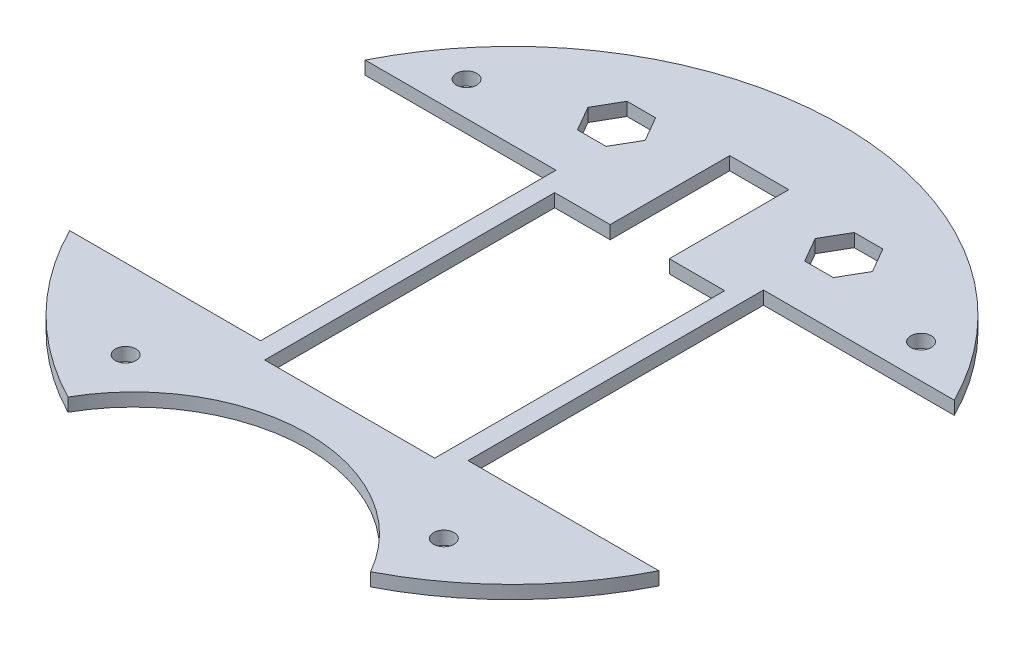
from build123d import *

# Parameters (mm, degrees)
BOSS_EXTRUDE1_DEPTH  = 2.9
SOLENOID_PLACEMENT_W = 37.4
SOLENOID_PLACEMENT_H = 63.8
CUT_EXTRUDE1_DEPTH   = 103.571487266
CUT_EXTRUDE3_DEPTH   = 103.571487266
SKETCH4_W            = 13
SKETCH4_H            = 26.3
CUT_EXTRUDE4_DEPTH   = 98.286484159
CUT_EXTRUDE5_DEPTH   = 98.286484159
SKETCH6_R            = 2.25
CUT_EXTRUDE6_DEPTH   = 98.286484159


with BuildPart() as part:
    # Sketch1 → Boss-Extrude1 (new body)
    with BuildSketch(Plane(origin=(0, 0, 0), x_dir=(1, 0, 0), z_dir=(0, 1, 0))):
        with BuildLine():
            ThreePointArc((33.29110537, -64.404598464), (0, 72.5), (-33.29110537, -64.404598464))
            ThreePointArc((-33.29110537, -64.404598464), (0, -44.989799638), (33.29110537, -64.404598464))
        make_face()
    extrude(amount=BOSS_EXTRUDE1_DEPTH)

    # solenoid placement → Cut-Extrude1 (cut, through all)
    with BuildSketch(Plane(origin=(0, 2.9, 0), x_dir=(1, 0, 0), z_dir=(0, 1, 0))):
        with Locations((0, -3.8)):
            Rectangle(SOLENOID_PLACEMENT_W, SOLENOID_PLACEMENT_H)
    extrude(amount=-CUT_EXTRUDE1_DEPTH, mode=Mode.SUBTRACT)

    # Sketch3 → Cut-Extrude3 (cut, through all)
    with BuildSketch(Plane(origin=(0, 2.9, 0), x_dir=(1, 0, 0), z_dir=(0, 1, 0))):
        with BuildLine():
            Line((-34.63, -32.5), (-22.83, -32.5))
            Line((-22.83, -32.5), (-22.83, 32.5))
            Line((-22.83, 32.5), (-64.807406984, 32.5))
            ThreePointArc((-64.807406984, 32.5), (-72.5, 0), (-64.807406984, -32.5))
            Line((-64.807406984, -32.5), (-34.63, -32.5))
        make_face()
        with BuildLine():
            Line((34.63, -32.5), (64.807406984, -32.5))
            ThreePointArc((64.807406984, -32.5), (72.5, 0), (64.807406984, 32.5))
            Line((64.807406984, 32.5), (22.83, 32.5))
            Line((22.83, 32.5), (22.83, -32.5))
            Line((22.83, -32.5), (34.63, -32.5))
        make_face()
    extrude(amount=-CUT_EXTRUDE3_DEPTH, mode=Mode.SUBTRACT)

    # Sketch4 → Cut-Extrude4 (cut, through all)
    with BuildSketch(Plane(origin=(0, 2.9, 0), x_dir=(1, 0, 0), z_dir=(0, 1, 0))):
        with Locations((0, 41.25)):
            Rectangle(SKETCH4_W, SKETCH4_H)
    extrude(amount=-CUT_EXTRUDE4_DEPTH, mode=Mode.SUBTRACT)

    # Sketch5 → Cut-Extrude5 (cut, through all)
    with BuildSketch(Plane(origin=(0, 2.9, 0), x_dir=(1, 0, 0), z_dir=(0, 1, 0))):
        Polygon((-18.706882066, 48), (-21.853441033, 53.45), (-28.146558967, 53.45), (-31.293117934, 48), (-28.146558967, 42.55), (-21.853441033, 42.55), align=None)
        Polygon((18.706882066, 48), (21.853441033, 42.55), (28.146558967, 42.55), (31.293117934, 48), (28.146558967, 53.45), (21.853441033, 53.45), align=None)
    extrude(amount=-CUT_EXTRUDE5_DEPTH, mode=Mode.SUBTRACT)

    # Sketch6 → Cut-Extrude6 (cut, through all)
    with BuildSketch(Plane(origin=(0, 2.9, 0), x_dir=(1, 0, 0), z_dir=(0, 1, 0))):
        with Locations(Location((35, -50, 0), (0, 0, 270))):
            Circle(SKETCH6_R)
        with Locations(Location((-35, -50, 0), (0, 0, 270))):
            Circle(SKETCH6_R)
        with Locations(Location((-50, 40, 0), (0, 0, 270))):
            Circle(SKETCH6_R)
        with Locations(Location((50, 40, 0), (0, 0, 270))):
            Circle(SKETCH6_R)
    extrude(amount=-CUT_EXTRUDE6_DEPTH, mode=Mode.SUBTRACT)


solid = part.part
